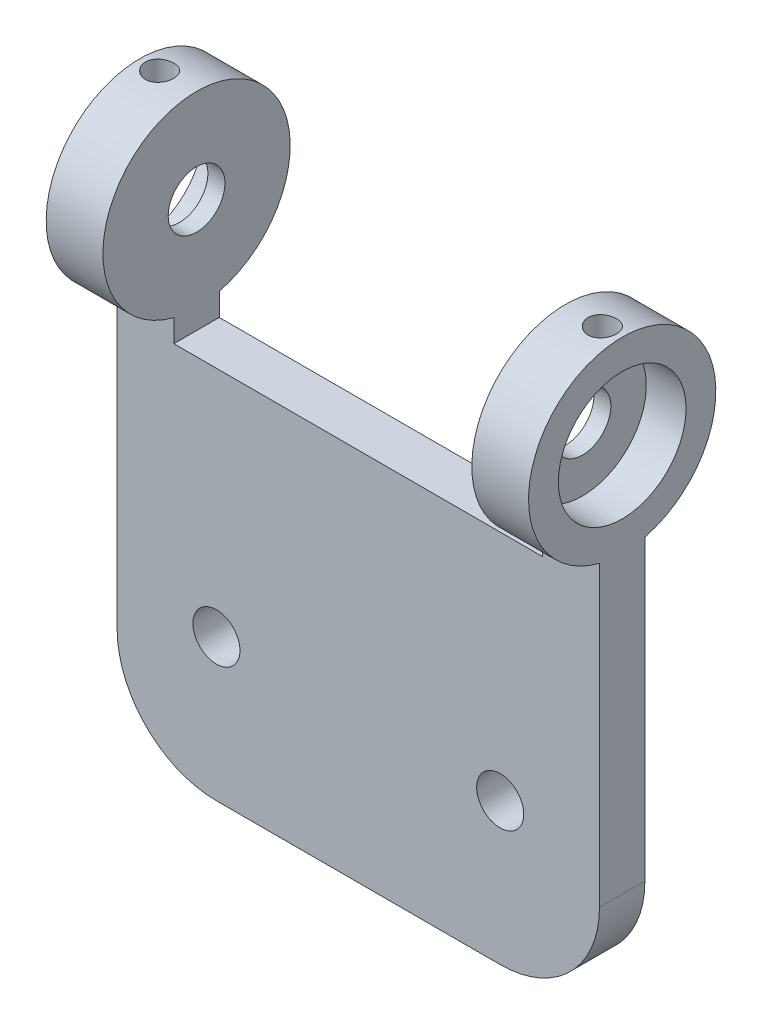
from build123d import *

# Parameters (mm, degrees)
BOSS_EXTRUDE1_DEPTH = 4
SKETCH7_R           = 4.15
BOSS_EXTRUDE3_DEPTH = 8
SKETCH8_R           = 16.5
BOSS_EXTRUDE4_DEPTH = 10
SKETCH9_R           = 11.25
CUT_EXTRUDE1_DEPTH  = 7
SKETCH10_R          = 5
CUT_EXTRUDE2_DEPTH  = 3
SKETCH11_R          = 2.5
CUT_EXTRUDE3_DEPTH  = 10


with BuildPart() as part:
    # Sketch2 → Boss-Extrude1 (new, symmetric)
    with BuildSketch(Plane.XY):
        Polygon((-42.5, 13.75), (-32.5, 13.75), (-32.5, -13.75), (32.5, -13.75), (32.5, 13.75), (42.5, 13.75), (42.5, -23.75), (-42.5, -23.75), align=None)
    extrude(amount=BOSS_EXTRUDE1_DEPTH, both=True)

    # Sketch7 → Boss-Extrude3 (add)
    with BuildSketch(Plane.XY.offset(4)):
        with BuildLine():
            Line((-42.5, -23.75), (-42.5, -62.25))
            ThreePointArc((-42.5, -62.25), (-37.374368671, -74.624368671), (-25, -79.75))
            Line((-25, -79.75), (25, -79.75))
            ThreePointArc((25, -79.75), (37.374368671, -74.624368671), (42.5, -62.25))
            Line((42.5, -62.25), (42.5, -23.75))
            Line((42.5, -23.75), (-42.5, -23.75))
        make_face()
        with Locations((-25, -54.75)):
            Circle(SKETCH7_R, mode=Mode.SUBTRACT)
        with Locations((25, -54.75)):
            Circle(SKETCH7_R, mode=Mode.SUBTRACT)
    extrude(amount=-BOSS_EXTRUDE3_DEPTH)

    # Sketch8 → Boss-Extrude4 (add)
    with BuildSketch(Plane.ZY.offset(42.5)):
        with Locations((0, 6.25)):
            Circle(SKETCH8_R)
    boss_extrude4 = extrude(amount=-BOSS_EXTRUDE4_DEPTH)

    # Sketch9 → Cut-Extrude1 (cut)
    with BuildSketch(Plane.ZY.offset(42.5)):
        with Locations((0, 6.25)):
            Circle(SKETCH9_R)
    cut_extrude1 = extrude(amount=-CUT_EXTRUDE1_DEPTH, mode=Mode.SUBTRACT)

    # Sketch10 → Cut-Extrude2 (cut)
    with BuildSketch(Plane.ZY.offset(35.5)):
        with Locations((0, 6.25)):
            Circle(SKETCH10_R)
    cut_extrude2 = extrude(amount=-CUT_EXTRUDE2_DEPTH, mode=Mode.SUBTRACT)

    # Mirror1: Boss-Extrude4, Cut-Extrude1, Cut-Extrude2 across plane
    add(boss_extrude4.mirror(Plane(origin=(0, 0, 0), x_dir=(0, 0, 1), z_dir=(1, 0, 0))))
    add(cut_extrude1.mirror(Plane(origin=(0, 0, 0), x_dir=(0, 0, 1), z_dir=(1, 0, 0))), mode=Mode.SUBTRACT)
    add(cut_extrude2.mirror(Plane(origin=(0, 0, 0), x_dir=(0, 0, 1), z_dir=(1, 0, 0))), mode=Mode.SUBTRACT)

    # Sketch11 → Cut-Extrude3 (cut)
    with BuildSketch(Plane(origin=(0, 22.75, 0), x_dir=(1, 0, 0), z_dir=(0, 1, 0))):
        with Locations(Location((-39, 0, 0), (0, 0, 270))):
            Circle(SKETCH11_R)
        with Locations(Location((39, 0, 0), (0, 0, 270))):
            Circle(SKETCH11_R)
    extrude(amount=-CUT_EXTRUDE3_DEPTH, mode=Mode.SUBTRACT)


solid = part.part
